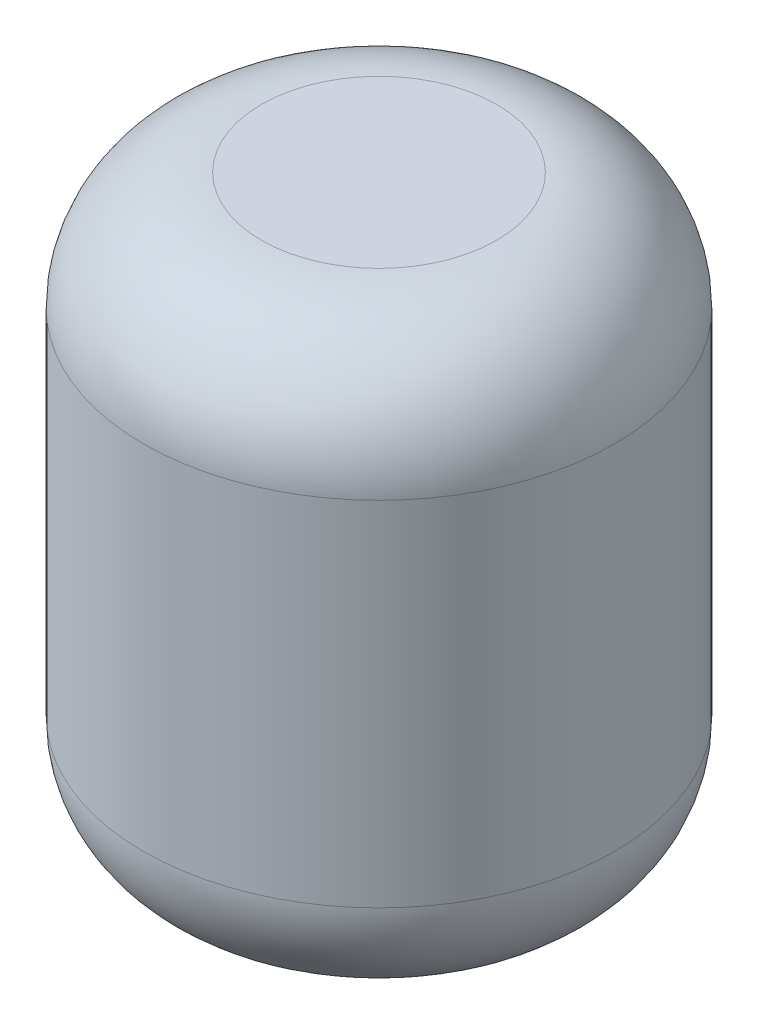
from build123d import *

# Parameters (mm, degrees)
SKETCH1_R           = 50.8
BOSS_EXTRUDE1_DEPTH = 127
FILLET1_R           = 25.4
FILLET2_R           = 25.4


with BuildPart() as part:
    # Sketch1 → Boss-Extrude1 (new body)
    with BuildSketch(Plane(origin=(0, 0, 0), x_dir=(1, 0, 0), z_dir=(0, 1, 0))):
        with Locations(Location((0, 0, 0), (0, 0, 270))):
            Circle(SKETCH1_R)
    extrude(amount=BOSS_EXTRUDE1_DEPTH)

    # Fillet1
    fillet1_edges = [part.edges().sort_by_distance(p)[0] for p in [
        (0, 127, -50.8),
    ]]
    fillet(fillet1_edges, radius=FILLET1_R)

    # Fillet2
    fillet2_edges = [part.edges().sort_by_distance(p)[0] for p in [
        (0, 0, -50.8),
    ]]
    fillet(fillet2_edges, radius=FILLET2_R)


solid = part.part
